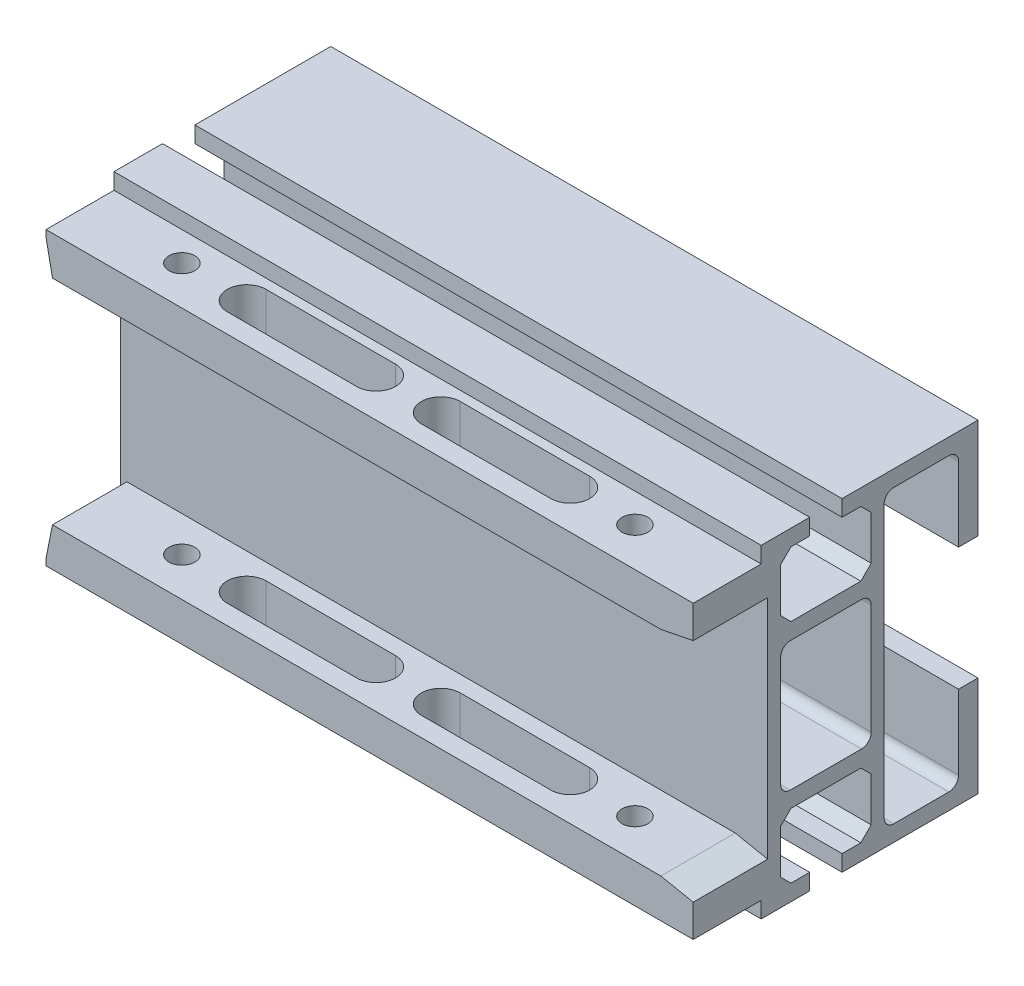
from build123d import *
from OCP.BRepFilletAPI import BRepFilletAPI_MakeChamfer

# Parameters (mm, degrees)
SCHIZZO1_W                   = 100
SCHIZZO1_H                   = 50
ESTRUSIONE_ESTRUSIONE1_DEPTH = 44
SCHIZZO2_W                   = 10.499999851
SCHIZZO2_H                   = 2.500000367
TAGLIO_ESTRUSIONE1_DEPTH     = 106.722514159
TAGLIO_ESTRUSIONE2_DEPTH     = 106.722514247
TAGLIO_ESTRUSIONE3_DEPTH     = 106.722514247
TAGLIO_ESTRUSIONE4_DEPTH     = 106.722514247
SCHIZZO6_W                   = 10.499999851
SCHIZZO6_H                   = 2.500000367
TAGLIO_ESTRUSIONE5_DEPTH     = 106.722514247
SCHIZZO7_W                   = 11.49999996
SCHIZZO7_H                   = 32.999999858
TAGLIO_ESTRUSIONE6_DEPTH     = 106.722514247
TAGLIO_ESTRUSIONE7_REACH     = 115.175
TAGLIO_ESTRUSIONE8_REACH     = 115.175
TAGLIO_ESTRUSIONE9_REACH     = 115.175
TAGLIO_ESTRUSIONE10_REACH    = 115.175
SCHIZZO12_W                  = 14.000000092
SCHIZZO12_H                  = 20
TAGLIO_ESTRUSIONE11_DEPTH    = 106.722514247
FORO_4_0_4_1_D               = 4
FORO_4_0_4_1_DEPTH           = 8.500000443
FORO_4_0_4_2_D               = 4
FORO_4_0_4_2_DEPTH           = 47.500000379
SMUSSO1_SIZE                 = 5
SMUSSO1_SIZE2                = 1
SMUSSO2_SIZE                 = 1.6
SMUSSO3_SIZE                 = 1
SMUSSO3_SIZE2                = 5
RACCORDO1_R                  = 1.5


with BuildPart() as part:
    # Schizzo1 → Estrusione-Estrusione1 (new body)
    with BuildSketch(Plane(origin=(0, 0, -23.5), x_dir=(-1, 0, 0), z_dir=(0, 0, -1))):
        with Locations((-50, 0)):
            Rectangle(SCHIZZO1_W, SCHIZZO1_H)
    extrude(amount=-ESTRUSIONE_ESTRUSIONE1_DEPTH)

    # Schizzo2 → Taglio-Estrusione1 (cut, through all)
    with BuildSketch(Plane.ZY):
        with Locations((15.250000075, -23.750000189)):
            Rectangle(SCHIZZO2_W, SCHIZZO2_H)
    extrude(amount=-TAGLIO_ESTRUSIONE1_DEPTH, mode=Mode.SUBTRACT)

    # Schizzo3 → Taglio-Estrusione2 (cut, through all)
    with BuildSketch(Plane.ZY):
        Polygon((-2.5, -25), (2.5, -25), (2.5, -22.5), (7, -22.5), (7, -12.5), (-7, -12.5), (-7, -22.5), (-2.5, -22.5), align=None)
    extrude(amount=-TAGLIO_ESTRUSIONE2_DEPTH, mode=Mode.SUBTRACT)

    # Schizzo4 → Taglio-Estrusione3 (cut, through all)
    with BuildSketch(Plane.ZY):
        Polygon((-23.5, 9.5), (-23.5, -9.5), (-20.5, -9.5), (-20.5, -22.5), (-9, -22.5), (-9, 22.5), (-20.5, 22.5), (-20.5, 9.5), align=None)
    extrude(amount=-TAGLIO_ESTRUSIONE3_DEPTH, mode=Mode.SUBTRACT)

    # Schizzo5 → Taglio-Estrusione4 (cut, through all)
    with BuildSketch(Plane.ZY):
        Polygon((2.5, 25), (-2.5, 25), (-2.5, 22.5), (-7, 22.5), (-7, 12.5), (7, 12.5), (7, 22.5), (2.5, 22.5), align=None)
    extrude(amount=-TAGLIO_ESTRUSIONE4_DEPTH, mode=Mode.SUBTRACT)

    # Schizzo6 → Taglio-Estrusione5 (cut, through all)
    with BuildSketch(Plane.ZY):
        with Locations((15.250000075, 23.750000189)):
            Rectangle(SCHIZZO6_W, SCHIZZO6_H)
    extrude(amount=-TAGLIO_ESTRUSIONE5_DEPTH, mode=Mode.SUBTRACT)

    # Schizzo7 → Taglio-Estrusione6 (cut, through all)
    with BuildSketch(Plane.ZY):
        with Locations((14.75000002, 0)):
            Rectangle(SCHIZZO7_W, SCHIZZO7_H)
    extrude(amount=-TAGLIO_ESTRUSIONE6_DEPTH, mode=Mode.SUBTRACT)

    # Schizzo8 → Taglio-Estrusione7 (cut, up to next)
    with BuildSketch(Plane(origin=(0, 22.500000006, 0), x_dir=(-1, 0, 0), z_dir=(0, 1, 0)), mode=Mode.PRIVATE) as taglio_estrusione7_sk1:
        with BuildLine():
            Line((-75, 11.500000046), (-55, 11.500000046))
            ThreePointArc((-55, 11.500000046), (-52, 14.500000046), (-55, 17.500000046))
            Line((-55, 17.500000046), (-75, 17.500000046))
            ThreePointArc((-75, 17.500000046), (-78, 14.500000046), (-75, 11.500000046))
        make_face()
    taglio_estrusione7_tool1 = extrude(taglio_estrusione7_sk1.sketch, amount=-TAGLIO_ESTRUSIONE7_REACH, mode=Mode.PRIVATE) & part.part
    add(taglio_estrusione7_tool1.solids().sort_by_distance((65, 22.5, 14.5))[0], mode=Mode.SUBTRACT)

    # Schizzo9 → Taglio-Estrusione8 (cut, up to next)
    with BuildSketch(Plane(origin=(0, 22.500000006, 0), x_dir=(-1, 0, 0), z_dir=(0, 1, 0)), mode=Mode.PRIVATE) as taglio_estrusione8_sk1:
        with BuildLine():
            Line((-25, 17.500000046), (-45, 17.500000046))
            ThreePointArc((-45, 17.500000046), (-48, 14.500000046), (-45, 11.500000046))
            Line((-45, 11.500000046), (-25, 11.500000046))
            ThreePointArc((-25, 11.500000046), (-22, 14.500000046), (-25, 17.500000046))
        make_face()
    taglio_estrusione8_tool1 = extrude(taglio_estrusione8_sk1.sketch, amount=-TAGLIO_ESTRUSIONE8_REACH, mode=Mode.PRIVATE) & part.part
    add(taglio_estrusione8_tool1.solids().sort_by_distance((35, 22.5, 14.5))[0], mode=Mode.SUBTRACT)

    # Schizzo10 → Taglio-Estrusione9 (cut, up to next)
    with BuildSketch(Plane.XZ.offset(22.500000006), mode=Mode.PRIVATE) as taglio_estrusione9_sk1:
        with BuildLine():
            Line((55, 11.500000046), (75, 11.500000046))
            ThreePointArc((75, 11.500000046), (78, 14.500000046), (75, 17.500000046))
            Line((75, 17.500000046), (55, 17.500000046))
            ThreePointArc((55, 17.500000046), (52, 14.500000046), (55, 11.500000046))
        make_face()
    taglio_estrusione9_tool1 = extrude(taglio_estrusione9_sk1.sketch, amount=-TAGLIO_ESTRUSIONE9_REACH, mode=Mode.PRIVATE) & part.part
    add(taglio_estrusione9_tool1.solids().sort_by_distance((65, -22.5, 14.5))[0], mode=Mode.SUBTRACT)

    # Schizzo11 → Taglio-Estrusione10 (cut, up to next)
    with BuildSketch(Plane.XZ.offset(22.500000006), mode=Mode.PRIVATE) as taglio_estrusione10_sk1:
        with BuildLine():
            Line((45, 17.500000046), (25, 17.500000046))
            ThreePointArc((25, 17.500000046), (22, 14.500000046), (25, 11.500000046))
            Line((25, 11.500000046), (45, 11.500000046))
            ThreePointArc((45, 11.500000046), (48, 14.500000046), (45, 17.500000046))
        make_face()
    taglio_estrusione10_tool1 = extrude(taglio_estrusione10_sk1.sketch, amount=-TAGLIO_ESTRUSIONE10_REACH, mode=Mode.PRIVATE) & part.part
    add(taglio_estrusione10_tool1.solids().sort_by_distance((35, -22.5, 14.5))[0], mode=Mode.SUBTRACT)

    # Schizzo12 → Taglio-Estrusione11 (cut, through all)
    with BuildSketch(Plane.ZY):
        Rectangle(SCHIZZO12_W, SCHIZZO12_H)
    extrude(amount=-TAGLIO_ESTRUSIONE11_DEPTH, mode=Mode.SUBTRACT)

    # Foro Ø4.0 (4)-1
    with Locations(Plane(origin=(0, 16.499999929, 0), x_dir=(-1, 0, 0), z_dir=(0, -1, 0))):
        with Locations((-85, -14.500000203), (-15, -14.500000203)):
            Hole(FORO_4_0_4_1_D / 2, depth=FORO_4_0_4_1_DEPTH)

    # Foro Ø4.0 (4)-2
    with Locations(Plane(origin=(0, -22.500000006, 0), x_dir=(-1, 0, 0), z_dir=(0, -1, 0))):
        with Locations((-85, -14.5), (-15, -14.5)):
            Hole(FORO_4_0_4_2_D / 2, depth=FORO_4_0_4_2_DEPTH)

    # Smusso1: one chamfer whose edges measure the first distance from different faces: ONE call of the kernel's chamfer builder (chamfer() names one face for all edges)
    smusso1_edges_1 = [part.edges().sort_by_distance(p)[0] for p in [
        (100, 16.499999929, 14.75000002),
    ]]
    smusso1_side_1 = [part.faces().sort_by_distance(p)[0] for p in [
        (50, 16.499999929, 14.847088678),
    ]]
    smusso1_edges_2 = [part.edges().sort_by_distance(p)[0] for p in [
        (0, -16.499999929, 14.75000002),
    ]]
    smusso1_side_2 = [part.faces().sort_by_distance(p)[0] for p in [
        (0, -17.25, -22.833966968),
    ]]
    smusso1 = BRepFilletAPI_MakeChamfer(part.part.solid().wrapped)
    for e in smusso1_edges_1:
        smusso1.Add(SMUSSO1_SIZE, SMUSSO1_SIZE2, e.wrapped, smusso1_side_1[0].wrapped)  # the first distance lies on this face
    for e in smusso1_edges_2:
        smusso1.Add(SMUSSO1_SIZE, SMUSSO1_SIZE2, e.wrapped, smusso1_side_2[0].wrapped)  # the first distance lies on this face
    add(Compound.cast(smusso1.Shape()), mode=Mode.REPLACE)

    # Smusso2
    smusso2_edges = [part.edges().sort_by_distance(p)[0] for p in [
        (50, 12.5, 7),
        (50, 12.5, -7),
        (50, 22.5, -7),
        (50, -22.5, -7),
        (50, -12.5, -7),
        (50, -12.5, 7),
        (50, -22.5, 7),
        (50, 22.5, 7),
    ]]
    chamfer(smusso2_edges, length=SMUSSO2_SIZE)

    # Smusso3: one chamfer whose edges measure the first distance from different faces: ONE call of the kernel's chamfer builder (chamfer() names one face for all edges)
    smusso3_edges_1 = [part.edges().sort_by_distance(p)[0] for p in [
        (100, -16.499999929, 14.75000002),
    ]]
    smusso3_side_1 = [part.faces().sort_by_distance(p)[0] for p in [
        (100, -23.166033032, 3.95),
    ]]
    smusso3_edges_2 = [part.edges().sort_by_distance(p)[0] for p in [
        (0, 16.499999929, 14.75000002),
    ]]
    smusso3_side_2 = [part.faces().sort_by_distance(p)[0] for p in [
        (47.5, 16.499999929, 19.543064788),
    ]]
    smusso3 = BRepFilletAPI_MakeChamfer(part.part.solid().wrapped)
    for e in smusso3_edges_1:
        smusso3.Add(SMUSSO3_SIZE, SMUSSO3_SIZE2, e.wrapped, smusso3_side_1[0].wrapped)  # the first distance lies on this face
    for e in smusso3_edges_2:
        smusso3.Add(SMUSSO3_SIZE, SMUSSO3_SIZE2, e.wrapped, smusso3_side_2[0].wrapped)  # the first distance lies on this face
    add(Compound.cast(smusso3.Shape()), mode=Mode.REPLACE)

    # Raccordo1
    raccordo1_edges = [part.edges().sort_by_distance(p)[0] for p in [
        (50, -10, 7.000000046),
        (50, -10, -7.000000046),
        (50, 10, -7.000000046),
        (50, 10, 7.000000046),
        (50, 22.5, -20.5),
        (50, 22.5, -9),
        (50, -22.5, -9),
        (50, -22.5, -20.5),
    ]]
    fillet(raccordo1_edges, radius=RACCORDO1_R)


solid = part.part
